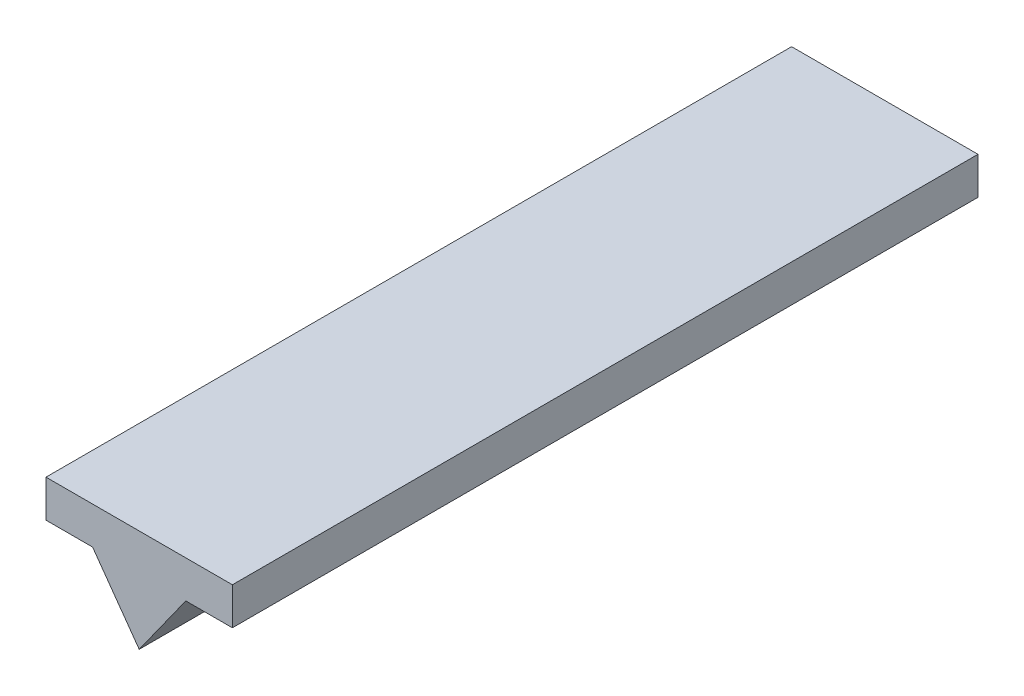
from build123d import *

# Parameters (mm, degrees)
BOSS_EXTRUDE1_DEPTH = 8


with BuildPart() as part:
    # Sketch1 → Boss-Extrude1 (new body)
    with BuildSketch(Plane.XY):
        Polygon((0, 0), (2, 0), (2, -0.4), (1.5, -0.4), (1, -1.1), (0.5, -0.4), (0, -0.4), align=None)
    extrude(amount=BOSS_EXTRUDE1_DEPTH)


solid = part.part
